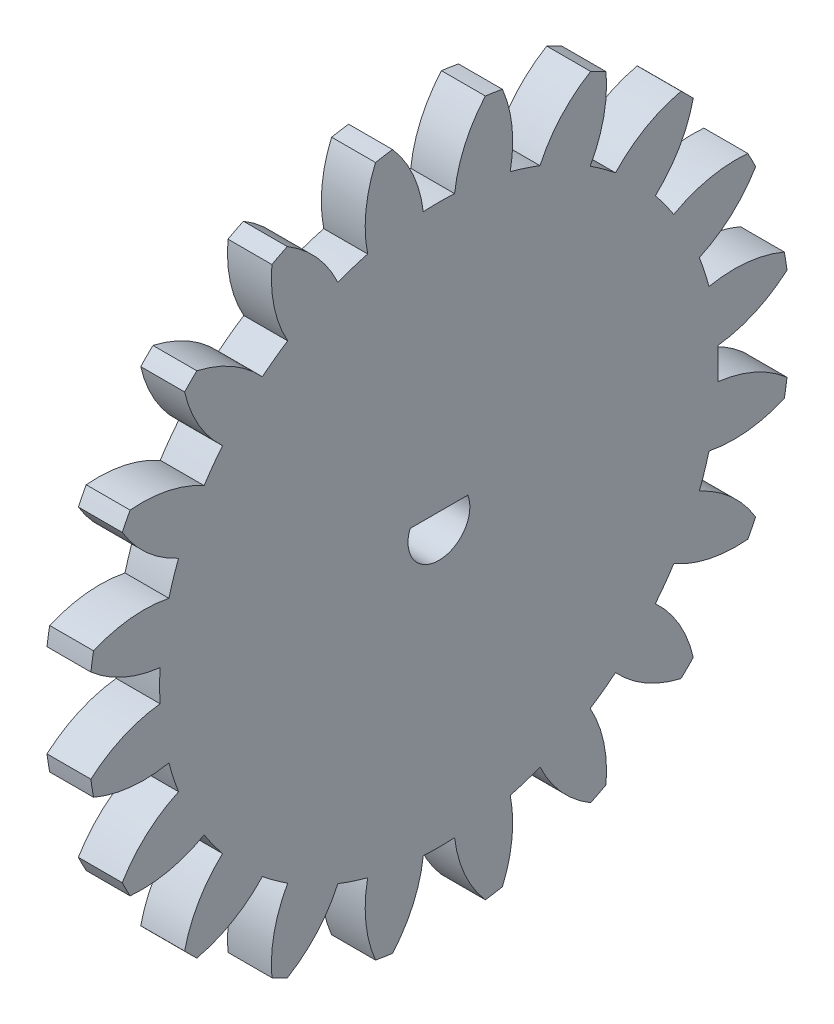
from build123d import *

# Parameters (mm, degrees)
BASPROSKE_W           = 5.5
BASPROSKE_H           = 44
TOOTHCUT_DEPTH        = 63.467991804
TEETHCUTS_COUNT       = 20
TEETHCUTS_ANGLE       = 342
BORSKE_R              = 0.5
BORE_DEPTH            = 50.0000508
CORTAR_EXTRUIR1_DEPTH = 5.5


with BuildPart() as part:
    # BasProSke → Base-Revolve (revolve)
    with BuildSketch(Plane(origin=(0, 0, 0), x_dir=(1, 0, 0), z_dir=(0, 1, 0)), mode=Mode.PRIVATE) as base_revolve_sk:
        with Locations((2.75, 22)):
            Rectangle(BASPROSKE_W, BASPROSKE_H)
    revolve(base_revolve_sk.sketch.rotate(Axis((-10, 0, 0), (1, 0, 0)), 180), axis=Axis((-10, 0, 0), (1, 0, 0)))

    # TooCutSke → ToothCut (cut, through all)
    with BuildSketch(Plane(origin=(0, 0, 0), x_dir=(0, 0, -1), z_dir=(1, 0, 0))):
        with BuildLine():
            ThreePointArc((1.961730392, 34.943978235), (0, 34.999), (-1.961730392, 34.943978235))
            ThreePointArc((-1.961730392, 34.943978235), (-3.235659864, 39.585086827), (-5.832115241, 43.637395396))
            ThreePointArc((-5.832115241, 43.637395396), (0, 44.0254), (5.832115241, 43.637395396))
            ThreePointArc((5.832115241, 43.637395396), (3.235659864, 39.585086827), (1.961730392, 34.943978235))
        make_face()
    toothcut = extrude(amount=TOOTHCUT_DEPTH, mode=Mode.SUBTRACT)

    # TeethCuts: ToothCut ×20 about axis
    teethcuts_axis = Axis((-10, 0, 0), (1, 0, 0))
    for i in range(1, TEETHCUTS_COUNT):
        add(toothcut.rotate(teethcuts_axis, i * TEETHCUTS_ANGLE / (TEETHCUTS_COUNT - 1)), mode=Mode.SUBTRACT)

    # BorSke → Bore (cut, symmetric)
    with BuildSketch(Plane(origin=(0, 0, 0), x_dir=(0, 0, -1), z_dir=(1, 0, 0))):
        with Locations(Location((0, 0, 0), (0, 0, 180))):
            Circle(BORSKE_R)
    extrude(amount=BORE_DEPTH, both=True, mode=Mode.SUBTRACT)

    # Croquis1 → Cortar-Extruir1 (cut)
    with BuildSketch(Plane(origin=(5.5, 0, 0), x_dir=(0, 0, -1), z_dir=(1, 0, 0))):
        with BuildLine():
            Line((0, 1.395), (3.615190175, 1.395))
            ThreePointArc((3.615190175, 1.395), (3.809493859, 0.709493859), (3.875, 0))
            ThreePointArc((3.875, 0), (0, -3.875), (-3.875, 0))
            ThreePointArc((-3.875, 0), (-3.809493859, 0.709493859), (-3.615190175, 1.395))
            Line((-3.615190175, 1.395), (0, 1.395))
        make_face()
    extrude(amount=-CORTAR_EXTRUIR1_DEPTH, mode=Mode.SUBTRACT)


solid = part.part
